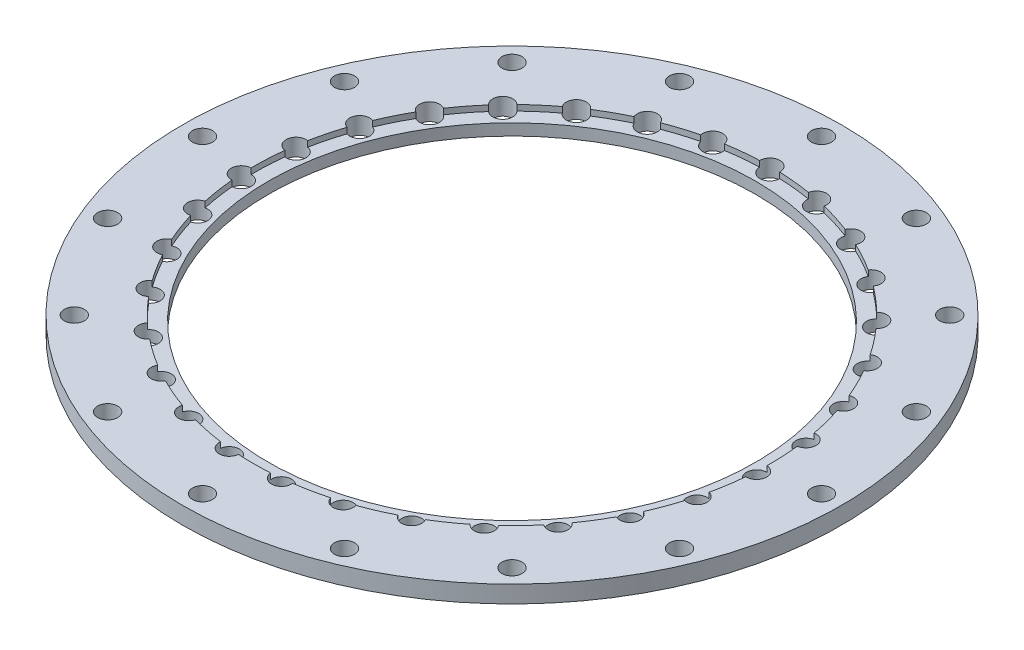
from build123d import *

# Parameters (mm, degrees)
SKETCH1_R                = 57.5
SKETCH1_R_2              = 45
BOSS_EXTRUDE1_DEPTH      = 13
BOSS_EXTRUDE2_START      = 1
SKETCH2_R                = 57.5
SKETCH2_R_2              = 45
BOSS_EXTRUDE2_DEPTH      = 1
BOSS_EXTRUDE3_START      = 2
SKETCH3_R                = 57.5
SKETCH3_R_2              = 42.5
BOSS_EXTRUDE3_DEPTH      = 2
SKETCH5_R                = 3
CUT_EXTRUDE2_DEPTH       = 13
FILLET4_R                = 0.5
SKETCH10_R               = 57.5
SKETCH10_R_2             = 45
BOSS_EXTRUDE4_DEPTH      = 1
SKETCH11_R               = 57.5
SKETCH11_R_2             = 42.5
BOSS_EXTRUDE5_DEPTH      = 2
SKETCH7_R                = 1.75
CUT_EXTRUDE3_DEPTH       = 23
CIRPATTERN3_COUNT        = 31
FILLET4_OF_CIRPATTERN3_R = 0.5
SKETCH4_R                = 1.75
CUT_EXTRUDE1_DEPTH       = 51
SKETCH14_R               = 84.700123292
CUT_EXTRUDE4_DEPTH       = 54


with BuildPart() as part:
    # Sketch1 → Boss-Extrude1 (new body)
    with BuildSketch(Plane(origin=(0, 0, 0), x_dir=(1, 0, 0), z_dir=(0, 1, 0))):
        with Locations(Location((0, 0, 0), (0, 0, 90))):
            Circle(SKETCH1_R)
        with Locations(Location((0, 0, 0), (0, 0, 90))):
            Circle(SKETCH1_R_2, mode=Mode.SUBTRACT)
    extrude(amount=BOSS_EXTRUDE1_DEPTH)

    # Sketch2 → Boss-Extrude2 (add)
    with BuildSketch(Plane.XZ.offset(BOSS_EXTRUDE2_START)):
        with Locations(Location((0, 0, 0), (0, 0, 270))):
            Circle(SKETCH2_R)
        with Locations(Location((0, 0, 0), (0, 0, 270))):
            Circle(SKETCH2_R_2, mode=Mode.SUBTRACT)
    extrude(amount=-BOSS_EXTRUDE2_DEPTH)

    # Sketch3 → Boss-Extrude3 (add)
    with BuildSketch(Plane.XZ.offset(1).offset(BOSS_EXTRUDE3_START)):
        with Locations(Location((0, 0, 0), (0, 0, 270))):
            Circle(SKETCH3_R)
        with Locations(Location((0, 0, 0), (0, 0, 270))):
            Circle(SKETCH3_R_2, mode=Mode.SUBTRACT)
    extrude(amount=-BOSS_EXTRUDE3_DEPTH)

    # Sketch5 → Cut-Extrude2 (cut)
    with BuildSketch(Plane(origin=(0, 13, 0), x_dir=(1, 0, 0), z_dir=(0, 1, 0))):
        with Locations((0, 45)):
            Circle(SKETCH5_R)
    cut_extrude2 = extrude(amount=-CUT_EXTRUDE2_DEPTH, mode=Mode.SUBTRACT)

    # Fillet4
    fillet4_edges = [part.edges().sort_by_distance(p)[0] for p in [
        (2.99833287, 6.5, -44.9),
        (-2.99833287, 6.5, -44.9),
    ]]
    fillet(fillet4_edges, radius=FILLET4_R)

    # Sketch10 → Boss-Extrude4 (add)
    with BuildSketch(Plane(origin=(0, 13, 0), x_dir=(1, 0, 0), z_dir=(0, 1, 0))):
        with Locations(Location((0, 0, 0), (0, 0, 90))):
            Circle(SKETCH10_R)
        with Locations(Location((0, 0, 0), (0, 0, 90))):
            Circle(SKETCH10_R_2, mode=Mode.SUBTRACT)
    extrude(amount=BOSS_EXTRUDE4_DEPTH)

    # Sketch11 → Boss-Extrude5 (add)
    with BuildSketch(Plane(origin=(0, 14, 0), x_dir=(1, 0, 0), z_dir=(0, 1, 0))):
        with Locations(Location((0, 0, 0), (0, 0, 90))):
            Circle(SKETCH11_R)
        with Locations(Location((0, 0, 0), (0, 0, 90))):
            Circle(SKETCH11_R_2, mode=Mode.SUBTRACT)
    extrude(amount=BOSS_EXTRUDE5_DEPTH)

    # Sketch7 → Cut-Extrude3 (cut)
    with BuildSketch(Plane(origin=(0, 16, 0), x_dir=(1, 0, 0), z_dir=(0, 1, 0))):
        with Locations(Location((0, 45, 0), (0, 0, 270))):
            Circle(SKETCH7_R)
    cut_extrude3 = extrude(amount=-CUT_EXTRUDE3_DEPTH, mode=Mode.SUBTRACT)

    # CirPattern3: Cut-Extrude2, Cut-Extrude3 ×31 about axis
    cirpattern3_axis = Axis((0, 0, 0), (0, 1, 0))
    add([cut_extrude2.rotate(cirpattern3_axis, i * 360 / CIRPATTERN3_COUNT) for i in range(1, CIRPATTERN3_COUNT)], mode=Mode.SUBTRACT)
    add([cut_extrude3.rotate(cirpattern3_axis, i * 360 / CIRPATTERN3_COUNT) for i in range(1, CIRPATTERN3_COUNT)], mode=Mode.SUBTRACT)

    # Fillet4 of CirPattern3
    fillet4_of_cirpattern3_edges = [part.edges().sort_by_distance(p)[0] for p in [
        (-6.101346732, 6.5, -44.584454332),
        (-11.975260372, 6.5, -43.377334393),
        (-14.951236482, 6.5, -42.443615865),
        (-20.461919307, 6.5, -40.078795619),
        (-23.189020853, 6.5, -38.565130777),
        (-28.110864862, 6.5, -35.139426243),
        (-30.477443987, 6.5, -33.107784704),
        (-34.608948306, 6.5, -28.761444629),
        (-36.518116982, 6.5, -26.295002036),
        (-39.690137341, 6.5, -21.205966091),
        (-41.063733978, 6.5, -18.405698895),
        (-43.146407489, 6.5, -12.782312811),
        (-43.92819688, 6.5, -9.762864278),
        (-44.836258645, 6.5, -3.835350142),
        (-44.99423424, 6.5, -0.720336851),
        (-44.690508104, 6.5, 5.268632212),
        (-44.218202364, 6.5, 8.351681252),
        (-42.715122911, 6.5, 14.156916145),
        (-41.631872087, 6.5, 17.081780543),
        (-38.990975566, 6.5, 22.465614267),
        (-37.341128076, 6.5, 25.112549731),
        (-33.670533101, 6.5, 29.854567501),
        (-31.521633894, 6.5, 32.115208183),
        (-26.971615054, 6.5, 36.021271235),
        (-24.411640317, 6.5, 37.803066239),
        (-19.168475919, 6.5, 40.713259891),
        (-16.302231317, 6.5, 41.943262321),
        (-10.580577126, 6.5, 43.738442904),
        (-7.525407051, 6.5, 44.366296315),
        (-1.559508263, 6.5, 44.972968926),
        (1.559508263, 6.5, 44.972968926),
        (7.525407051, 6.5, 44.366296315),
        (10.580577126, 6.5, 43.738442904),
        (16.302231317, 6.5, 41.943262321),
        (19.168475919, 6.5, 40.713259891),
        (24.411640317, 6.5, 37.803066239),
        (26.971615054, 6.5, 36.021271235),
        (31.521633894, 6.5, 32.115208183),
        (33.670533101, 6.5, 29.854567501),
        (37.341128076, 6.5, 25.112549731),
        (38.990975566, 6.5, 22.465614267),
        (41.631872087, 6.5, 17.081780543),
        (42.715122911, 6.5, 14.156916145),
        (44.218202364, 6.5, 8.351681252),
        (44.690508104, 6.5, 5.268632212),
        (44.99423424, 6.5, -0.720336851),
        (44.836258645, 6.5, -3.835350142),
        (43.92819688, 6.5, -9.762864278),
        (43.146407489, 6.5, -12.782312811),
        (41.063733978, 6.5, -18.405698895),
        (39.690137341, 6.5, -21.205966091),
        (36.518116982, 6.5, -26.295002036),
        (34.608948306, 6.5, -28.761444629),
        (30.477443987, 6.5, -33.107784704),
        (28.110864862, 6.5, -35.139426243),
        (23.189020853, 6.5, -38.565130777),
        (20.461919307, 6.5, -40.078795619),
        (14.951236482, 6.5, -42.443615865),
        (11.975260372, 6.5, -43.377334393),
        (6.101346732, 6.5, -44.584454332),
    ]]
    fillet(fillet4_of_cirpattern3_edges, radius=FILLET4_OF_CIRPATTERN3_R)

    # Sketch4 → Cut-Extrude1 (cut)
    with BuildSketch(Plane(origin=(0, 16, 0), x_dir=(1, 0, 0), z_dir=(0, 1, 0))):
        with Locations(Location((0, 54, 0), (0, 0, 270))):
            Circle(SKETCH4_R)
        with Locations(Location((20.664905348, 49.889494756, 0), (0, 0, 270))):
            Circle(SKETCH4_R)
        with Locations(Location((38.183766184, 38.183766184, 0), (0, 0, 270))):
            Circle(SKETCH4_R)
        with Locations(Location((49.889494756, 20.664905348, 0), (0, 0, 270))):
            Circle(SKETCH4_R)
        with Locations(Location((54, 0, 0), (0, 0, 270))):
            Circle(SKETCH4_R)
        with Locations(Location((49.889494756, -20.664905348, 0), (0, 0, 270))):
            Circle(SKETCH4_R)
        with Locations(Location((38.183766184, -38.183766184, 0), (0, 0, 270))):
            Circle(SKETCH4_R)
        with Locations(Location((20.664905348, -49.889494756, 0), (0, 0, 270))):
            Circle(SKETCH4_R)
        with Locations(Location((0, -54, 0), (0, 0, 270))):
            Circle(SKETCH4_R)
        with Locations(Location((-20.664905348, -49.889494756, 0), (0, 0, 270))):
            Circle(SKETCH4_R)
        with Locations(Location((-38.183766184, -38.183766184, 0), (0, 0, 270))):
            Circle(SKETCH4_R)
        with Locations(Location((-49.889494756, -20.664905348, 0), (0, 0, 270))):
            Circle(SKETCH4_R)
        with Locations(Location((-54, 0, 0), (0, 0, 270))):
            Circle(SKETCH4_R)
        with Locations(Location((-49.889494756, 20.664905348, 0), (0, 0, 270))):
            Circle(SKETCH4_R)
        with Locations(Location((-38.183766184, 38.183766184, 0), (0, 0, 270))):
            Circle(SKETCH4_R)
        with Locations(Location((-20.664905348, 49.889494756, 0), (0, 0, 270))):
            Circle(SKETCH4_R)
    extrude(amount=-CUT_EXTRUDE1_DEPTH, mode=Mode.SUBTRACT)

    # Sketch14 → Cut-Extrude4 (cut)
    with BuildSketch(Plane(origin=(0, 0, 0), x_dir=(1, 0, 0), z_dir=(0, 1, 0))):
        Circle(SKETCH14_R)
    extrude(amount=CUT_EXTRUDE4_DEPTH, mode=Mode.SUBTRACT)


solid = part.part
